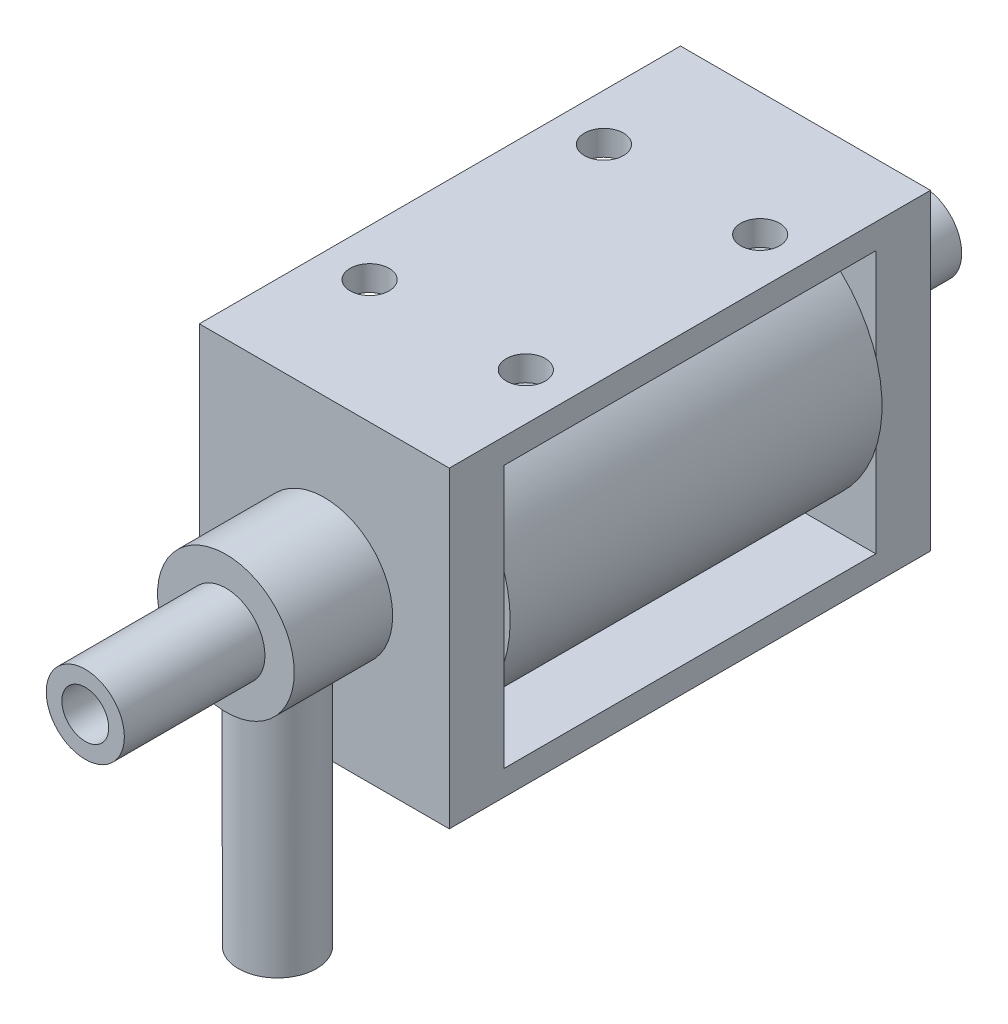
from build123d import *
from build123d.topology import SkipClean

# Parameters (mm, degrees)
FRAME_EXTRUDE_DEPTH                     = 8
FRAME_EXTRUDE_DEPTH_BACK                = 8
FRAME_SKETCH_W                          = 30.8
FRAME_SKETCH_H                          = 20
FRAME_SKETCH_W_2                        = 23.8
FRAME_SKETCH_H_2                        = 16.8
ELECTROMAGNET_EXTRUDE_REACH             = 22.029
ELECTROMAGNET_SKETCH_R                  = 8.4
ELECTROMAGNET_EXTRUDE_DIRECTION_2_REACH = 22.029
PORT_3_SKETCH_R                         = 2.5
PORT_3_SKETCH_R_2                       = 1.5
PORT_3_EXTRUDE_DEPTH                    = 7.5
PORT_3_SKETCH_3_R                       = 1.5
CENTER_HOLE_CUT_DEPTH                   = 34.45444664
BASE_OF_PORTS_1_2_SKETCH_R              = 4.375
BASE_OF_PORT_1_2_PORTS_DEPTH            = 6.3
PORT_2_SKETCH_R                         = 2.5
PORT_2_SKETCH_R_2                       = 1.5
PORT_2_EXTRUDE_DEPTH                    = 9
PORTS_1_SKETCH_R                        = 2.5
PORTS_1_SKETCH_R_2                      = 1.5
PORTS_1_EXTRUDE_DEPTH                   = 19
MOUNTING_HOLES_PROFILE_SKETCH_W         = 1.25
MOUNTING_HOLES_PROFILE_SKETCH_H         = 3.250185188
MOUNTING_HOLES_AT_2_COUNT               = 2
MOUNTING_HOLES_AT_2_PITCH               = 18.027756377
MOUNTING_HOLES_AT_3_COUNT               = 2
MOUNTING_HOLES_AT_3_PITCH               = 15
MOUNTING_HOLES_AT_4_COUNT               = 2
MOUNTING_HOLES_AT_4_PITCH               = 10


with BuildPart() as part:
    # Frame Sketch → Frame Extrude (new, two sides: drawn at the far end of the back side and taken through both)
    with BuildSketch(Plane(origin=(0, 0, 0), x_dir=(0, 0, -1), z_dir=(1, 0, 0)).offset(-FRAME_EXTRUDE_DEPTH_BACK)):
        Rectangle(FRAME_SKETCH_W, FRAME_SKETCH_H)
        Rectangle(FRAME_SKETCH_W_2, FRAME_SKETCH_H_2, mode=Mode.SUBTRACT)
    extrude(amount=FRAME_EXTRUDE_DEPTH + FRAME_EXTRUDE_DEPTH_BACK)


with BuildPart() as body_2:

    # Electromagnet Extrude: up to this face of the body (flat: up to its plane)
    electromagnet_extrude_end = Plane(part.part.faces().sort_by_distance((0, 0, 11.9))[0])
    # Electromagnet Sketch → Electromagnet Extrude (new, up to the picked face)
    with BuildSketch(Plane.XY, mode=Mode.PRIVATE) as electromagnet_extrude_sk1:
        with Locations(Location((0, 0, 0), (0, 0, 90))):
            Circle(ELECTROMAGNET_SKETCH_R)
    electromagnet_extrude_tool1 = split(extrude(electromagnet_extrude_sk1.sketch, amount=ELECTROMAGNET_EXTRUDE_REACH, mode=Mode.PRIVATE), bisect_by=electromagnet_extrude_end, keep=Keep.BOTH, mode=Mode.PRIVATE)
    add(electromagnet_extrude_tool1.solids().sort_by(Axis((0, 0, 0), (0, 0, 1)))[0])


    # Electromagnet Extrude direction 2: up to this face of the body (flat: up to its plane)
    electromagnet_extrude_direction_2_end = Plane(part.part.faces().sort_by_distance((0, 0, -11.9))[0])
    # Electromagnet Sketch → Electromagnet Extrude direction 2 (add, up to the picked face)
    with BuildSketch(Plane.XY, mode=Mode.PRIVATE) as electromagnet_extrude_direction_2_sk1:
        with Locations(Location((0, 0, 0), (0, 0, 90))):
            Circle(ELECTROMAGNET_SKETCH_R)
    electromagnet_extrude_direction_2_tool1 = split(extrude(electromagnet_extrude_direction_2_sk1.sketch, amount=-ELECTROMAGNET_EXTRUDE_DIRECTION_2_REACH, mode=Mode.PRIVATE), bisect_by=electromagnet_extrude_direction_2_end, keep=Keep.BOTH, mode=Mode.PRIVATE)
    add(electromagnet_extrude_direction_2_tool1.solids().sort_by(Axis((0, 0, 0), (0, 0, -1)))[0])


with BuildPart() as part_1:
    add(part.part)

    # Port 3 Sketch → Port 3 Extrude (add)
    with BuildSketch(Plane.XY.offset(-15.4)):
        Circle(PORT_3_SKETCH_R)
        Circle(PORT_3_SKETCH_R_2, mode=Mode.SUBTRACT)
    extrude(amount=-PORT_3_EXTRUDE_DEPTH)


with BuildPart() as center_hole_cut_tool:
    # Port 3 Sketch<3> → Center Hole Cut (new, through all)
    with SkipClean():  # the faces are left unmerged after this step: merging them gives an invalid solid
        with BuildSketch(Plane.XY.offset(-15.4)):
            with Locations(Location((0, 0, 0), (0, 0, 180))):
                Circle(PORT_3_SKETCH_3_R)
        extrude(amount=CENTER_HOLE_CUT_DEPTH)


with BuildPart() as part_2:
    with SkipClean():  # the faces are left unmerged after this step: merging them gives an invalid solid
        add(part_1.part)

        # Center Hole Cut: cut by center_hole_cut_tool
        add(center_hole_cut_tool.part, mode=Mode.SUBTRACT)

    # Mounting Holes Profile Sketch → Mounting Holes (revolve, cut)
    with SkipClean():  # the faces are left unmerged after this step: merging them gives an invalid solid
        with BuildSketch(Plane(origin=(5, 10, 7.5), x_dir=(0, 0, 1), z_dir=(1, 0, 0))):
            with Locations((0.625, 1.625092594)):
                Rectangle(MOUNTING_HOLES_PROFILE_SKETCH_W, MOUNTING_HOLES_PROFILE_SKETCH_H)
        mounting_holes = revolve(axis=Axis((5, 16.35, 7.5), (0, -1, 0)), mode=Mode.SUBTRACT)

    # Mounting Holes at 2: Mounting Holes ×2
    with SkipClean():  # the faces are left unmerged after this step: merging them gives an invalid solid
        with Locations(*[Vector(-0.5547001962252294, 0, -0.8320502943378435) * (i * MOUNTING_HOLES_AT_2_PITCH) for i in range(1, MOUNTING_HOLES_AT_2_COUNT)]):
            add(mounting_holes, mode=Mode.SUBTRACT)

    # Mounting Holes at 3: Mounting Holes ×2
    with SkipClean():  # the faces are left unmerged after this step: merging them gives an invalid solid
        with Locations(*[(0, 0, -i * MOUNTING_HOLES_AT_3_PITCH) for i in range(1, MOUNTING_HOLES_AT_3_COUNT)]):
            add(mounting_holes, mode=Mode.SUBTRACT)

    # Mounting Holes at 4: Mounting Holes ×2
    with SkipClean():  # the faces are left unmerged after this step: merging them gives an invalid solid
        with Locations(*[(-i * MOUNTING_HOLES_AT_4_PITCH, 0, 0) for i in range(1, MOUNTING_HOLES_AT_4_COUNT)]):
            add(mounting_holes, mode=Mode.SUBTRACT)


with BuildPart() as body_2_1:
    with SkipClean():  # the faces are left unmerged after this step: merging them gives an invalid solid
        add(body_2.part)

        # Center Hole Cut: cut by center_hole_cut_tool
        add(center_hole_cut_tool.part, mode=Mode.SUBTRACT)


with BuildPart() as body_3:
    # Base of Ports 1&2 Sketch → Base of Port 1&2 Ports (new body)
    with BuildSketch(Plane.XY.offset(15.4)):
        Circle(BASE_OF_PORTS_1_2_SKETCH_R)
    extrude(amount=BASE_OF_PORT_1_2_PORTS_DEPTH)

    # Port 2 Sketch → Port 2 Extrude (add)
    with BuildSketch(Plane.XY.offset(21.7)):
        Circle(PORT_2_SKETCH_R)
        Circle(PORT_2_SKETCH_R_2, mode=Mode.SUBTRACT)
    extrude(amount=PORT_2_EXTRUDE_DEPTH)

    # Ports 1 Sketch → Ports 1 Extrude (add)
    with BuildSketch(Plane(origin=(2.609545443, 0, 0), x_dir=(0, 0, -1), z_dir=(0, 1, 0))):
        with Locations(Location((-18.4, 2.609545443, 0), (0, 0, 180))):
            Circle(PORTS_1_SKETCH_R)
        with Locations(Location((-18.4, 2.609545443, 0), (0, 0, 180))):
            Circle(PORTS_1_SKETCH_R_2, mode=Mode.SUBTRACT)
    extrude(amount=-PORTS_1_EXTRUDE_DEPTH)


solid = Compound([part_2.part, body_2_1.part, body_3.part])
